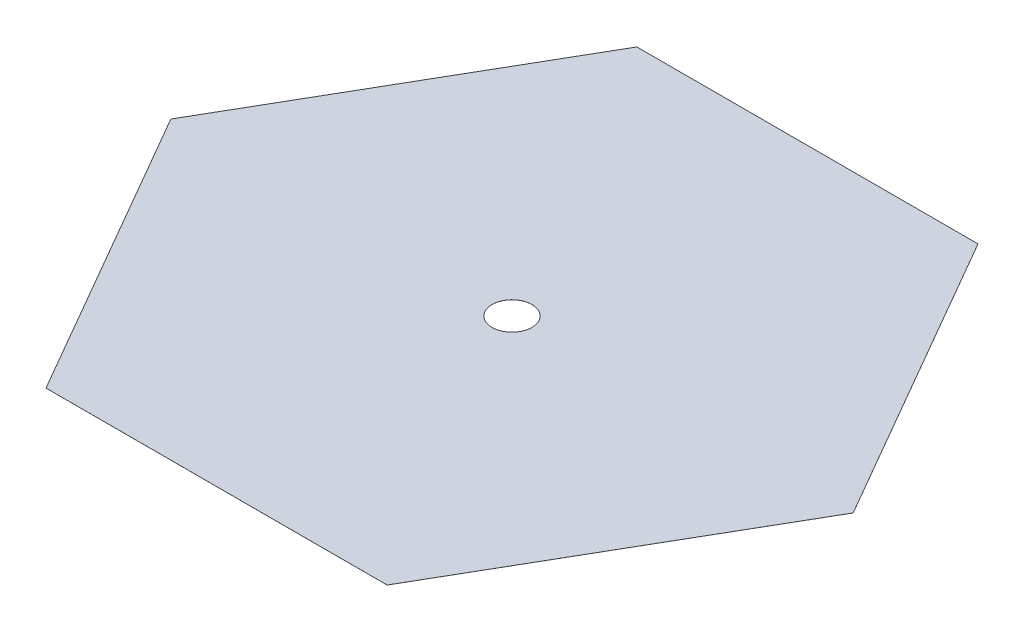
from build123d import *

# Parameters (mm, degrees)
EXTRUDE_1_DEPTH     = 0.06
SKETCH_2_R          = 35
CUT_EXTRUDE_1_DEPTH = 0.06


with BuildPart() as part:
    # Эскиз1 → Бобышка-Вытянуть1 (new body)
    with BuildSketch(Plane(origin=(0, 0, 0), x_dir=(1, 0, 0), z_dir=(0, 1, 0))):
        Polygon((-600, 0), (-300, -519.615242271), (300, -519.615242271), (600, 0), (300, 519.615242271), (-300, 519.615242271), align=None)
    extrude(amount=EXTRUDE_1_DEPTH)

    # Эскиз2 → Вырез-Вытянуть1 (cut)
    with BuildSketch(Plane(origin=(0, 0.06, 0), x_dir=(1, 0, 0), z_dir=(0, 1, 0))):
        with Locations(Location((0, 0, 0), (0, 0, 270))):
            Circle(SKETCH_2_R)
    extrude(amount=-CUT_EXTRUDE_1_DEPTH, mode=Mode.SUBTRACT)


solid = part.part
